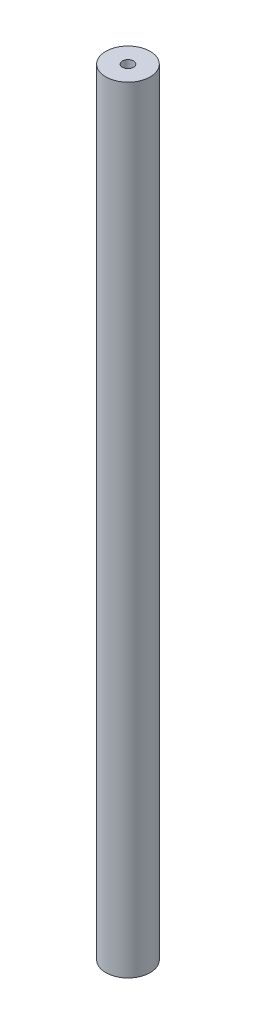
from build123d import *

# Parameters (mm, degrees)
SKETCH1_R           = 12.7
BOSS_EXTRUDE1_DEPTH = 444.5
SKETCH2_R           = 3.175
CUT_EXTRUDE1_DEPTH  = 25.4


with BuildPart() as part:
    # Sketch1 → Boss-Extrude1 (new body)
    with BuildSketch(Plane(origin=(0, 0, 0), x_dir=(1, 0, 0), z_dir=(0, 1, 0))):
        with Locations(Location((0, 0, 0), (0, 0, 270))):
            Circle(SKETCH1_R)
    extrude(amount=BOSS_EXTRUDE1_DEPTH)

    # Sketch2 → Cut-Extrude1 (cut)
    with BuildSketch(Plane(origin=(0, 444.5, 0), x_dir=(1, 0, 0), z_dir=(0, 1, 0))):
        with Locations(Location((0, 0, 0), (0, 0, 270))):
            Circle(SKETCH2_R)
    cut_extrude1 = extrude(amount=-CUT_EXTRUDE1_DEPTH, mode=Mode.SUBTRACT)

    # Mirror1: Cut-Extrude1 across plane
    add(cut_extrude1.mirror(Plane.ZX.offset(222.25)), mode=Mode.SUBTRACT)


solid = part.part
